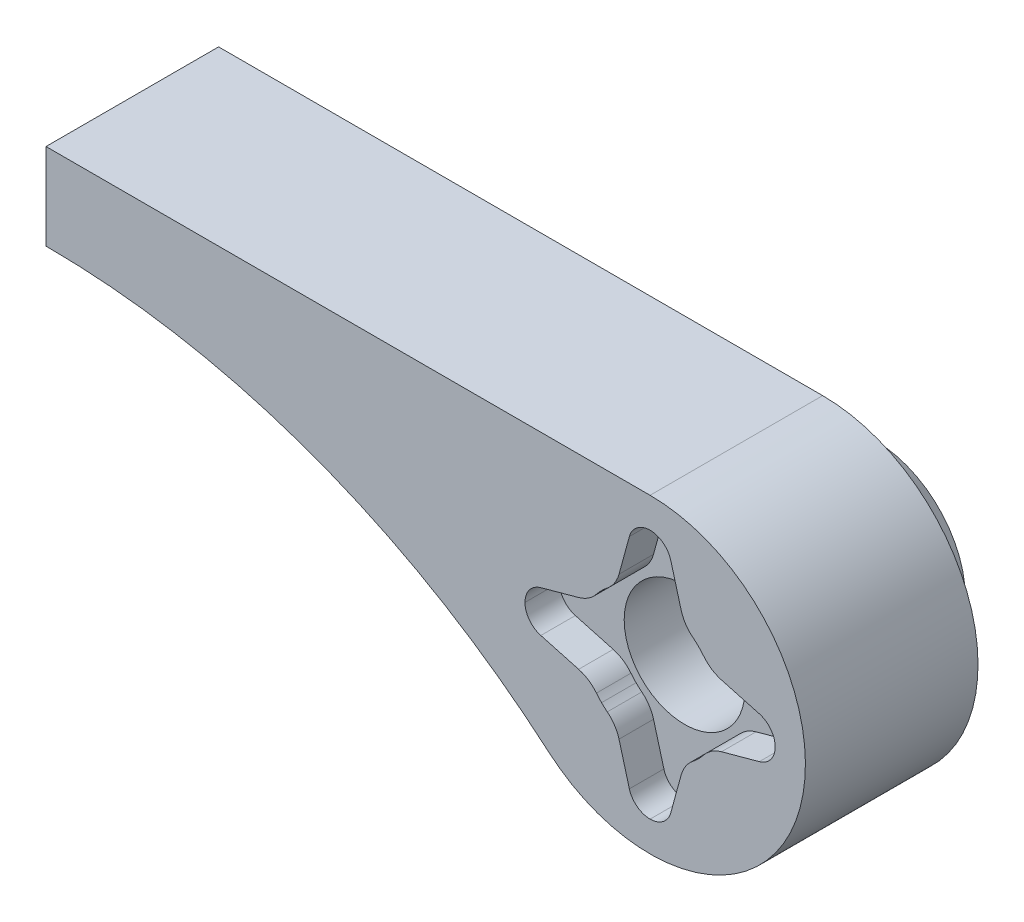
from build123d import *

# Parameters (mm, degrees)
SKETCH1_R             = 9
BOSS_EXTRUDE1_DEPTH   = 10
BODY_MOVE_COPY1_ANGLE = 180
CUT_EXTRUDE5_DEPTH    = 2
SKETCH19_R            = 7
BOSS_EXTRUDE12_DEPTH  = 3
BOSS_EXTRUDE12_TAPER  = 30
SKETCH20_R            = 3.5
CUT_EXTRUDE6_DEPTH    = 39.405728739


with BuildPart() as part:
    # Sketch1 → Boss-Extrude1 (new body)
    with BuildSketch(Plane.XY):
        Circle(SKETCH1_R)
        with BuildLine():
            Line((-35, -9), (0, -9))
            ThreePointArc((0, -9), (-8.437416666, -3.132091953), (-5.872614409, 6.82))
            ThreePointArc((-5.872614409, 6.82), (-19.465199243, -1.204217751), (-35, -4))
            Line((-35, -4), (-35, -9))
        make_face()
    extrude(amount=BOSS_EXTRUDE1_DEPTH)


with BuildPart() as part_1:
    # Body-Move/Copy1: moved
    add(part.part.rotate(Axis((0, 0, 3.5), (1, 0, 0)), BODY_MOVE_COPY1_ANGLE))

    # Sketch18 → Cut-Extrude5 (cut)
    with BuildSketch(Plane.XY.offset(7)):
        with BuildLine():
            Line((1.2, -6.33), (1.8, -4.1378116))
            ThreePointArc((1.8, -4.1378116), (2.058560194, -3.569045514), (2.48, -3.1078116))
            ThreePointArc((2.48, -3.1078116), (2.64989874, -2.964295475), (2.811558399, -2.811558399))
            ThreePointArc((2.811558399, -2.811558399), (2.964295475, -2.64989874), (3.1078116, -2.48))
            ThreePointArc((3.1078116, -2.48), (3.569045514, -2.058560194), (4.1378116, -1.8))
            Line((4.1378116, -1.8), (6.33, -1.2))
            ThreePointArc((6.33, -1.2), (6.992020752, -0.754882576), (7.25, 0))
            ThreePointArc((7.25, 0), (6.992020752, 0.754882576), (6.33, 1.2))
            Line((6.33, 1.2), (4.1378116, 1.8))
            ThreePointArc((4.1378116, 1.8), (3.569045514, 2.058560194), (3.1078116, 2.48))
            ThreePointArc((3.1078116, 2.48), (2.964295475, 2.64989874), (2.811558399, 2.811558399))
            ThreePointArc((2.811558399, 2.811558399), (2.64989874, 2.964295475), (2.48, 3.1078116))
            ThreePointArc((2.48, 3.1078116), (2.058560194, 3.569045514), (1.8, 4.1378116))
            Line((1.8, 4.1378116), (1.2, 6.33))
            ThreePointArc((1.2, 6.33), (0.754882576, 6.992020752), (0, 7.25))
            ThreePointArc((0, 7.25), (-0.754882576, 6.992020752), (-1.2, 6.33))
            Line((-1.2, 6.33), (-1.8, 4.1378116))
            ThreePointArc((-1.8, 4.1378116), (-2.058560194, 3.569045514), (-2.48, 3.1078116))
            ThreePointArc((-2.48, 3.1078116), (-2.64989874, 2.964295475), (-2.811558399, 2.811558399))
            ThreePointArc((-2.811558399, 2.811558399), (-2.964295475, 2.64989874), (-3.1078116, 2.48))
            ThreePointArc((-3.1078116, 2.48), (-3.569045514, 2.058560194), (-4.1378116, 1.8))
            Line((-4.1378116, 1.8), (-6.33, 1.2))
            ThreePointArc((-6.33, 1.2), (-6.992020752, 0.754882576), (-7.25, 0))
            ThreePointArc((-7.25, 0), (-6.992020752, -0.754882576), (-6.33, -1.2))
            Line((-6.33, -1.2), (-4.1378116, -1.8))
            ThreePointArc((-4.1378116, -1.8), (-3.569045514, -2.058560194), (-3.1078116, -2.48))
            ThreePointArc((-3.1078116, -2.48), (-2.964295475, -2.64989874), (-2.811558399, -2.811558399))
            ThreePointArc((-2.811558399, -2.811558399), (-2.64989874, -2.964295475), (-2.48, -3.1078116))
            ThreePointArc((-2.48, -3.1078116), (-2.058560194, -3.569045514), (-1.8, -4.1378116))
            Line((-1.8, -4.1378116), (-1.2, -6.33))
            ThreePointArc((-1.2, -6.33), (-0.754882576, -6.992020752), (0, -7.25))
            ThreePointArc((0, -7.25), (0.754882576, -6.992020752), (1.2, -6.33))
        make_face()
    extrude(amount=-CUT_EXTRUDE5_DEPTH, mode=Mode.SUBTRACT)

    # Sketch19 → Boss-Extrude12 (add)
    with BuildSketch(Plane(origin=(0, 0, -3), x_dir=(-1, 0, 0), z_dir=(0, 0, -1))):
        Circle(SKETCH19_R)
    extrude(amount=BOSS_EXTRUDE12_DEPTH, taper=BOSS_EXTRUDE12_TAPER)

    # Sketch20 → Cut-Extrude6 (cut, through all)
    with BuildSketch(Plane(origin=(0, 0, -6), x_dir=(-1, 0, 0), z_dir=(0, 0, -1))):
        with Locations(Location((0, 0, 0), (0, 0, 90))):
            Circle(SKETCH20_R)
    extrude(amount=-CUT_EXTRUDE6_DEPTH, mode=Mode.SUBTRACT)


solid = part_1.part
